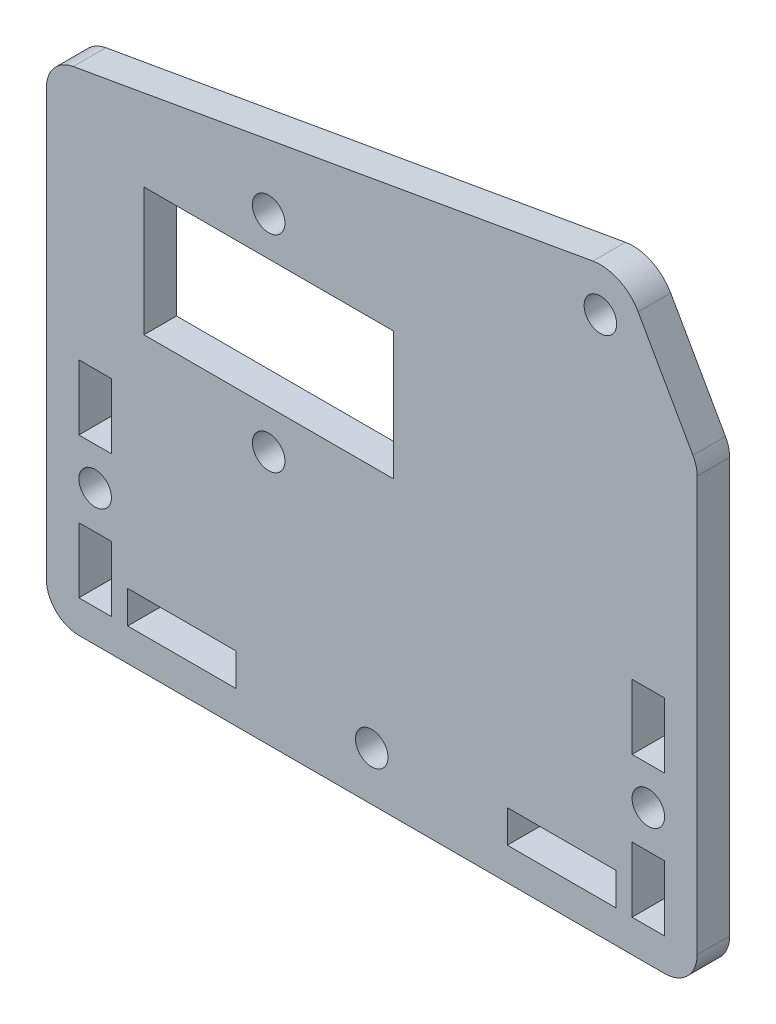
from build123d import *

# Parameters (mm, degrees)
ESQUISSE13_R        = 1.5
ESQUISSE13_W        = 3
ESQUISSE13_H        = 6
ESQUISSE13_W_2      = 10
ESQUISSE13_H_2      = 3
ESQUISSE13_W_3      = 23
ESQUISSE13_H_3      = 11.8
BOSS_EXTRU_13_DEPTH = 3


with BuildPart() as part:
    # Esquisse13 → Boss.-Extru.13 (new body)
    with BuildSketch(Plane.XY):
        with BuildLine():
            Line((157.12523298, -14.425795559), (103.12523298, -14.425795559))
            ThreePointArc((103.12523298, -14.425795559), (101.003912637, -13.547115902), (100.12523298, -11.425795559))
            Line((100.12523298, -11.425795559), (100.12523298, 27.781080254))
            ThreePointArc((100.12523298, 27.781080254), (100.827637897, 29.710084358), (102.605937537, 30.735793817))
            Line((102.605937537, 30.735793817), (150.512449504, 39.155436821))
            ThreePointArc((150.512449504, 39.155436821), (152.911964034, 38.833240365), (154.686087677, 37.185828505))
            Line((154.686087677, 37.185828505), (159.736166166, 28.261732306))
            ThreePointArc((159.736166166, 28.261732306), (160.02633618, 27.548162294), (160.12523298, 26.784224979))
            Line((160.12523298, 26.784224979), (160.12523298, -11.425795559))
            ThreePointArc((160.12523298, -11.425795559), (159.246553324, -13.547115902), (157.12523298, -14.425795559))
        make_face()
        with Locations((151.204843429, 35.215818737)):
            Circle(ESQUISSE13_R, mode=Mode.SUBTRACT)
        with Locations((130.12523298, -9.925795559)):
            Circle(ESQUISSE13_R, mode=Mode.SUBTRACT)
        with Locations((120.62523298, 8.974204441)):
            Circle(ESQUISSE13_R, mode=Mode.SUBTRACT)
        with Locations((120.62523298, 27.974204441)):
            Circle(ESQUISSE13_R, mode=Mode.SUBTRACT)
        with Locations((155.62523298, -1.925795559)):
            Circle(ESQUISSE13_R, mode=Mode.SUBTRACT)
        with Locations((104.62523298, -1.925795559)):
            Circle(ESQUISSE13_R, mode=Mode.SUBTRACT)
        with Locations((104.62523298, -8.425795559)):
            Rectangle(ESQUISSE13_W, ESQUISSE13_H, mode=Mode.SUBTRACT)
        with Locations((112.62523298, -9.925795559)):
            Rectangle(ESQUISSE13_W_2, ESQUISSE13_H_2, mode=Mode.SUBTRACT)
        with Locations((155.62523298, -8.425795559)):
            Rectangle(ESQUISSE13_W, ESQUISSE13_H, mode=Mode.SUBTRACT)
        with Locations((147.62523298, -9.925795559)):
            Rectangle(ESQUISSE13_W_2, ESQUISSE13_H_2, mode=Mode.SUBTRACT)
        with Locations((104.62523298, 4.574204441)):
            Rectangle(ESQUISSE13_W, ESQUISSE13_H, mode=Mode.SUBTRACT)
        with Locations((155.62523298, 4.574204441)):
            Rectangle(ESQUISSE13_W, ESQUISSE13_H, mode=Mode.SUBTRACT)
        with Locations((120.62523298, 18.474204441)):
            Rectangle(ESQUISSE13_W_3, ESQUISSE13_H_3, mode=Mode.SUBTRACT)
    extrude(amount=BOSS_EXTRU_13_DEPTH)


solid = part.part
